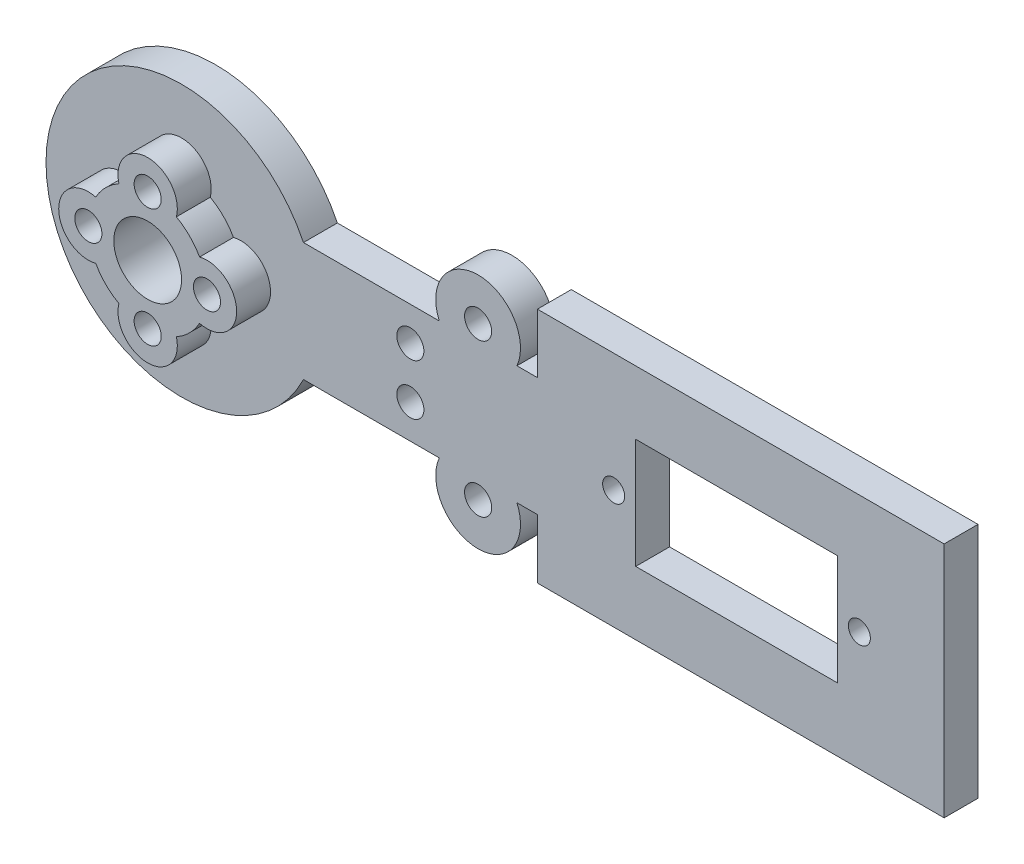
from build123d import *

# Parameters (mm, degrees)
MAIN_WEB_PROFILE_W                      = 60
MAIN_WEB_PROFILE_H                      = 14
MAIN_WEB_DEPTH                          = 4
SHOULDER_HORN_FLANGE_PROFILE_R          = 16
SHOULDER_HORN_FLANGE_DEPTH              = 4
ELBOW_SERVO_MOUNT_PROFILE_W             = 48
ELBOW_SERVO_MOUNT_PROFILE_H             = 28
ELBOW_SERVO_MOUNT_DEPTH                 = 4
SG90_BODY_CLEARANCE_START               = -5
SG90_BODY_CLEARANCE_PROFILE_W           = 23.8
SG90_BODY_CLEARANCE_PROFILE_H           = 13
SG90_BODY_CLEARANCE_DEPTH               = 97.49863387
ELBOW_TAB_FASTENERS_START               = -50
ELBOW_TAB_FASTENERS_PROFILE_R           = 1.3
ELBOW_TAB_FASTENERS_DEPTH               = 142.49863387
SHOULDER_CENTER_SCREW_ACCESS_START      = -50
SHOULDER_CENTER_SCREW_ACCESS_PROFILE_R  = 4
SHOULDER_CENTER_SCREW_ACCESS_DEPTH      = 142.49863387
CABLE_TIE_HOLES_START                   = -50
CABLE_TIE_HOLES_PROFILE_R               = 1.6
CABLE_TIE_HOLES_DEPTH                   = 142.49863387
PASSIVE_LOWER_MOUNT_BOSS_PROFILE_R      = 5
PASSIVE_LOWER_MOUNT_BOSS_DEPTH          = 4
PASSIVE_UPPER_MOUNT_BOSS_PROFILE_R      = 5
PASSIVE_UPPER_MOUNT_BOSS_DEPTH          = 4
PASSIVE_CHEEK_STANDOFFS_START           = -50
PASSIVE_CHEEK_STANDOFFS_PROFILE_R       = 1.6
PASSIVE_CHEEK_STANDOFFS_DEPTH           = 142.49863387
SHOULDER_DOWEL_SUPPORT_HUB_START        = 4
SHOULDER_DOWEL_SUPPORT_HUB_PROFILE_R    = 7
SHOULDER_DOWEL_SUPPORT_HUB_PROFILE_R_2  = 4
SHOULDER_DOWEL_SUPPORT_HUB_DEPTH        = 4
RAISED_M3_WASHER_SEATS_HEIGHT8_START    = 4
RAISED_M3_WASHER_SEATS_PCD14_PROFILE_R  = 3.5
RAISED_M3_WASHER_SEATS_HEIGHT8_DEPTH    = 4
METAL_HORN_M3_CLEARANCE_PCD14_START     = -50
METAL_HORN_M3_CLEARANCE_PCD14_PROFILE_R = 1.6
METAL_HORN_M3_CLEARANCE_PCD14_DEPTH     = 142.760557976
RESTORE_SHOULDER_SLEEVE_BORE_START      = -50
RESTORE_SHOULDER_SLEEVE_BORE_PROFILE_R  = 4
RESTORE_SHOULDER_SLEEVE_BORE_DEPTH      = 142.760557976


with BuildPart() as part:
    # Main_web_profile → Main_web (new body)
    with BuildSketch(Plane.XY):
        with Locations((30, 0)):
            Rectangle(MAIN_WEB_PROFILE_W, MAIN_WEB_PROFILE_H)
    extrude(amount=MAIN_WEB_DEPTH)

    # Shoulder_horn_flange_profile → Shoulder_horn_flange (add)
    with BuildSketch(Plane.XY):
        Circle(SHOULDER_HORN_FLANGE_PROFILE_R)
    extrude(amount=SHOULDER_HORN_FLANGE_DEPTH)

    # Elbow_servo_mount_profile → Elbow_servo_mount (add)
    with BuildSketch(Plane.XY):
        with Locations((66, 0)):
            Rectangle(ELBOW_SERVO_MOUNT_PROFILE_W, ELBOW_SERVO_MOUNT_PROFILE_H)
    extrude(amount=ELBOW_SERVO_MOUNT_DEPTH)

    # SG90_body_clearance_profile → SG90_body_clearance (cut, through all)
    with BuildSketch(Plane.XY.offset(SG90_BODY_CLEARANCE_START)):
        with Locations((65.5, 0)):
            Rectangle(SG90_BODY_CLEARANCE_PROFILE_W, SG90_BODY_CLEARANCE_PROFILE_H)
    extrude(amount=SG90_BODY_CLEARANCE_DEPTH, mode=Mode.SUBTRACT)

    # Elbow_tab_fasteners_profile → Elbow_tab_fasteners (cut, through all)
    with BuildSketch(Plane.XY.offset(ELBOW_TAB_FASTENERS_START)):
        with Locations(Location((51, 0, 0), (0, 0, 180))):
            Circle(ELBOW_TAB_FASTENERS_PROFILE_R)
        with Locations(Location((80, 0, 0), (0, 0, 180))):
            Circle(ELBOW_TAB_FASTENERS_PROFILE_R)
    extrude(amount=ELBOW_TAB_FASTENERS_DEPTH, mode=Mode.SUBTRACT)

    # Shoulder_center_screw_access_profile → Shoulder_center_screw_access (cut, through all)
    with BuildSketch(Plane.XY.offset(SHOULDER_CENTER_SCREW_ACCESS_START)):
        with Locations(Location((0, 0, 0), (0, 0, 180))):
            Circle(SHOULDER_CENTER_SCREW_ACCESS_PROFILE_R)
    extrude(amount=SHOULDER_CENTER_SCREW_ACCESS_DEPTH, mode=Mode.SUBTRACT)

    # Cable_tie_holes_profile → Cable_tie_holes (cut, through all)
    with BuildSketch(Plane.XY.offset(CABLE_TIE_HOLES_START)):
        with Locations(Location((27, -3, 0), (0, 0, 180))):
            Circle(CABLE_TIE_HOLES_PROFILE_R)
        with Locations(Location((27, 3, 0), (0, 0, 180))):
            Circle(CABLE_TIE_HOLES_PROFILE_R)
    extrude(amount=CABLE_TIE_HOLES_DEPTH, mode=Mode.SUBTRACT)

    # Passive_lower_mount_boss_profile → Passive_lower_mount_boss (add)
    with BuildSketch(Plane.XY):
        with Locations((35, -9)):
            Circle(PASSIVE_LOWER_MOUNT_BOSS_PROFILE_R)
    extrude(amount=PASSIVE_LOWER_MOUNT_BOSS_DEPTH)

    # Passive_upper_mount_boss_profile → Passive_upper_mount_boss (add)
    with BuildSketch(Plane.XY):
        with Locations((35, 9)):
            Circle(PASSIVE_UPPER_MOUNT_BOSS_PROFILE_R)
    extrude(amount=PASSIVE_UPPER_MOUNT_BOSS_DEPTH)

    # Passive_cheek_standoffs_profile → Passive_cheek_standoffs (cut, through all)
    with BuildSketch(Plane.XY.offset(PASSIVE_CHEEK_STANDOFFS_START)):
        with Locations(Location((35, -9, 0), (0, 0, 180))):
            Circle(PASSIVE_CHEEK_STANDOFFS_PROFILE_R)
        with Locations(Location((35, 9, 0), (0, 0, 180))):
            Circle(PASSIVE_CHEEK_STANDOFFS_PROFILE_R)
    extrude(amount=PASSIVE_CHEEK_STANDOFFS_DEPTH, mode=Mode.SUBTRACT)

    # Shoulder_dowel_support_hub_profile → Shoulder_dowel_support_hub (add)
    with BuildSketch(Plane.XY.offset(SHOULDER_DOWEL_SUPPORT_HUB_START)):
        Circle(SHOULDER_DOWEL_SUPPORT_HUB_PROFILE_R)
        with Locations(Location((0, 0, 0), (0, 0, 180))):
            Circle(SHOULDER_DOWEL_SUPPORT_HUB_PROFILE_R_2, mode=Mode.SUBTRACT)
    extrude(amount=SHOULDER_DOWEL_SUPPORT_HUB_DEPTH)

    # Raised_M3_washer_seats_PCD14_profile → Raised_M3_washer_seats_height8 (add)
    with BuildSketch(Plane.XY.offset(RAISED_M3_WASHER_SEATS_HEIGHT8_START)):
        with Locations((7, 0)):
            Circle(RAISED_M3_WASHER_SEATS_PCD14_PROFILE_R)
        with Locations((-7, 0)):
            Circle(RAISED_M3_WASHER_SEATS_PCD14_PROFILE_R)
        with Locations((0, 7)):
            Circle(RAISED_M3_WASHER_SEATS_PCD14_PROFILE_R)
        with Locations((0, -7)):
            Circle(RAISED_M3_WASHER_SEATS_PCD14_PROFILE_R)
    extrude(amount=RAISED_M3_WASHER_SEATS_HEIGHT8_DEPTH)

    # Metal_horn_M3_clearance_PCD14_profile → Metal_horn_M3_clearance_PCD14 (cut, through all)
    with BuildSketch(Plane.XY.offset(METAL_HORN_M3_CLEARANCE_PCD14_START)):
        with Locations(Location((7, 0, 0), (0, 0, 180))):
            Circle(METAL_HORN_M3_CLEARANCE_PCD14_PROFILE_R)
        with Locations(Location((-7, 0, 0), (0, 0, 180))):
            Circle(METAL_HORN_M3_CLEARANCE_PCD14_PROFILE_R)
        with Locations(Location((0, 7, 0), (0, 0, 180))):
            Circle(METAL_HORN_M3_CLEARANCE_PCD14_PROFILE_R)
        with Locations(Location((0, -7, 0), (0, 0, 180))):
            Circle(METAL_HORN_M3_CLEARANCE_PCD14_PROFILE_R)
    extrude(amount=METAL_HORN_M3_CLEARANCE_PCD14_DEPTH, mode=Mode.SUBTRACT)

    # Restore_shoulder_sleeve_bore_profile → Restore_shoulder_sleeve_bore (cut, through all)
    with BuildSketch(Plane.XY.offset(RESTORE_SHOULDER_SLEEVE_BORE_START)):
        with Locations(Location((0, 0, 0), (0, 0, 180))):
            Circle(RESTORE_SHOULDER_SLEEVE_BORE_PROFILE_R)
    extrude(amount=RESTORE_SHOULDER_SLEEVE_BORE_DEPTH, mode=Mode.SUBTRACT)


solid = part.part
